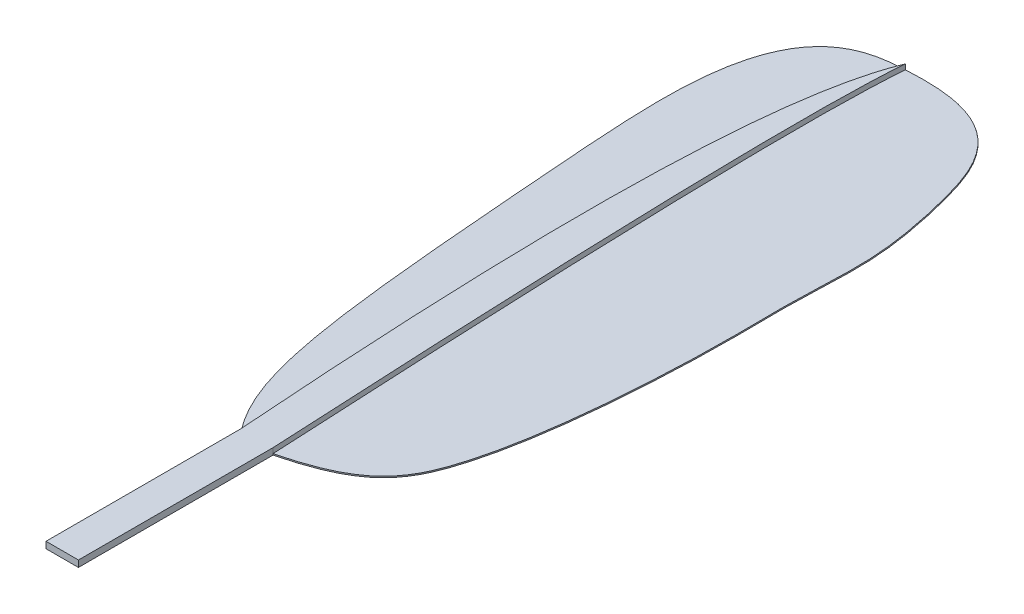
from build123d import *

# Parameters (mm, degrees)
BOSS_EXTRUDE1_DEPTH = 1
BOSS_EXTRUDE2_DEPTH = 0.2


with BuildPart() as part:
    # Sketch2 → Boss-Extrude1 (new body)
    with BuildSketch(Plane(origin=(0, 0, 0), x_dir=(1, 0, 0), z_dir=(0, 1, 0))):
        with BuildLine():
            add(Edge.make_bspline(
                [(-2.5, 0), (-8.331510312, 79.88522278), (0, 100)],
                knots=[0, 0, 0, 1, 1, 1], degree=2))
            Line((-2.5, 0), (-2.5, -30))
            Line((-2.5, -30), (2.5, -30))
            Line((2.5, -30), (2.5, 0))
            add(Edge.make_bspline(
                [(2.5, 0), (-1.639184348, 79.830180153), (0, 100)],
                knots=[0, 0, 0, 1, 1, 1], degree=2))
        make_face()
    extrude(amount=BOSS_EXTRUDE1_DEPTH)

    # Sketch2<4> → Boss-Extrude2 (add)
    with BuildSketch(Plane(origin=(0, 0, 0), x_dir=(1, 0, 0), z_dir=(0, 1, 0))):
        with BuildLine():
            add(Edge.make_bspline(
                [(0, 100), (-7.357536045, 99.756200735), (-16.639361455, 96.17273961), (-11.337654503, 24.227731288), (-9.557728223, 8.38325723), (-2.5, 0)],
                knots=[0, 0, 0, 0, 0.313531983, 0.413531983, 1, 1, 1, 1], degree=3))
            add(Edge.make_bspline(
                [(-2.5, 0), (-8.331510312, 79.88522278), (0, 100)],
                knots=[0, 0, 0, 1, 1, 1], degree=2))
        make_face()
        with BuildLine():
            add(Edge.make_bspline(
                [(2.5, 0), (12.934201307, 2.631077686), (20.622483583, 11.707615166), (22.554736081, 44.54303974), (22.004905999, 67.171785011), (23.810905146, 72.591766672), (16.919139759, 98.071207202), (8.942412889, 100.567138422), (0, 100)],
                knots=[0, 0, 0, 0, 0.15609962, 0.39468135, 0.460940872, 0.752435315, 0.809984908, 1, 1, 1, 1], degree=3))
            add(Edge.make_bspline(
                [(2.5, 0), (-1.639184348, 79.830180153), (0, 100)],
                knots=[0, 0, 0, 1, 1, 1], degree=2))
        make_face()
    extrude(amount=BOSS_EXTRUDE2_DEPTH)


solid = part.part
